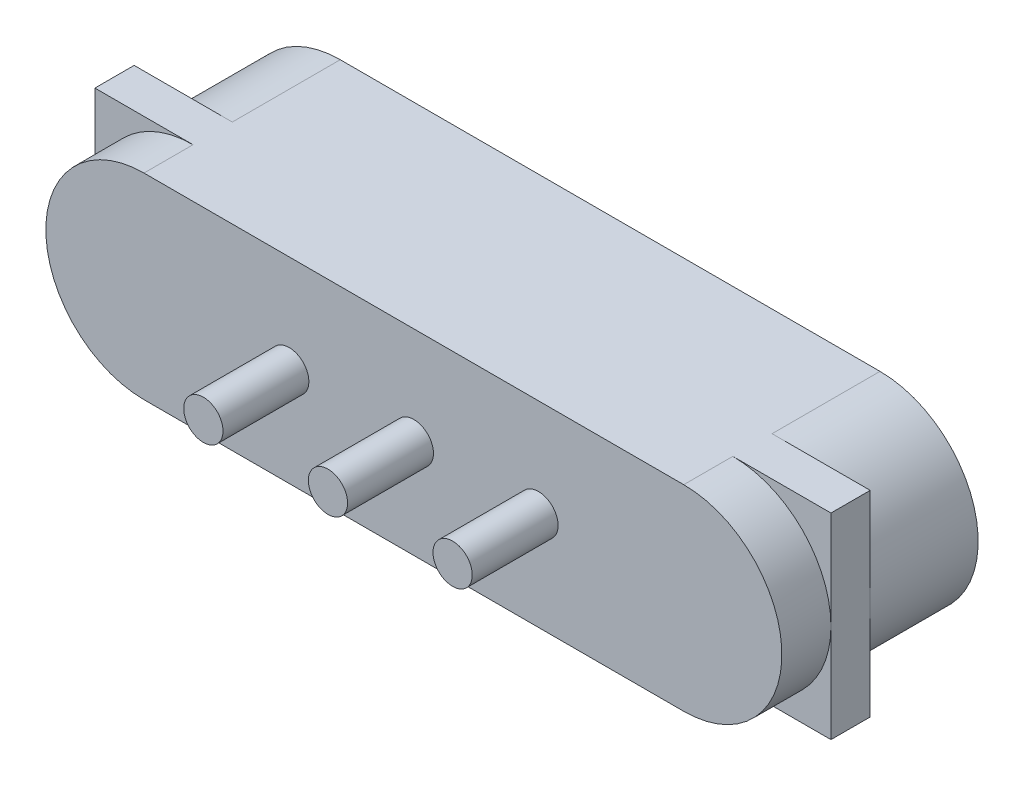
from build123d import *

# Parameters (mm, degrees)
EXTRUDE_1_DEPTH = 4
EXTRUDE_START   = -2.2
SKETCH_2_W      = 15
SKETCH_2_H      = 4
EXTRUDE_2_DEPTH = 0.8
SKETCH_3_R      = 0.5
EXTRUDE_3_DEPTH = 1
FILLET_1_R      = 0.5
SKETCH_4_R      = 0.4
EXTRUDE_4_DEPTH = 1.75


with BuildPart() as part:
    # 草图1 → 凸台-拉伸1 (new body)
    with BuildSketch(Plane.XY):
        with BuildLine():
            Line((0, 2), (11, 2))
            ThreePointArc((11, 2), (13, 0), (11, -2))
            Line((11, -2), (0, -2))
            ThreePointArc((0, -2), (-2, 0), (0, 2))
        make_face()
    extrude(amount=EXTRUDE_1_DEPTH)

    # 草图2 → 凸台-拉伸2 (add)
    with BuildSketch(Plane(origin=(0, 0, 0), x_dir=(-1, 0, 0), z_dir=(0, 0, -1)).offset(EXTRUDE_START)):
        with Locations((-5.5, 0)):
            Rectangle(SKETCH_2_W, SKETCH_2_H)
    extrude(amount=-EXTRUDE_2_DEPTH)

    # 草图3 → 凸台-拉伸3 (add)
    with BuildSketch(Plane(origin=(0, 0, 0), x_dir=(-1, 0, 0), z_dir=(0, 0, -1))):
        with Locations(Location((-8.04, 0, 0), (0, 0, 180))):
            Circle(SKETCH_3_R)
        with Locations(Location((-5.5, 0, 0), (0, 0, 180))):
            Circle(SKETCH_3_R)
        with Locations(Location((-2.96, 0, 0), (0, 0, 180))):
            Circle(SKETCH_3_R)
    extrude(amount=EXTRUDE_3_DEPTH)

    # 圆角1
    fillet_1_edges = [part.edges().sort_by_distance(p)[0] for p in [
        (7.54, 0, -1),
        (5, 0, -1),
        (2.46, 0, -1),
    ]]
    fillet(fillet_1_edges, radius=FILLET_1_R)

    # 草图4 → 凸台-拉伸4 (add)
    with BuildSketch(Plane.XY.offset(4)):
        with Locations((2.96, 0)):
            Circle(SKETCH_4_R)
        with Locations((5.5, 0)):
            Circle(SKETCH_4_R)
        with Locations((8.04, 0)):
            Circle(SKETCH_4_R)
    extrude(amount=EXTRUDE_4_DEPTH)


solid = part.part
